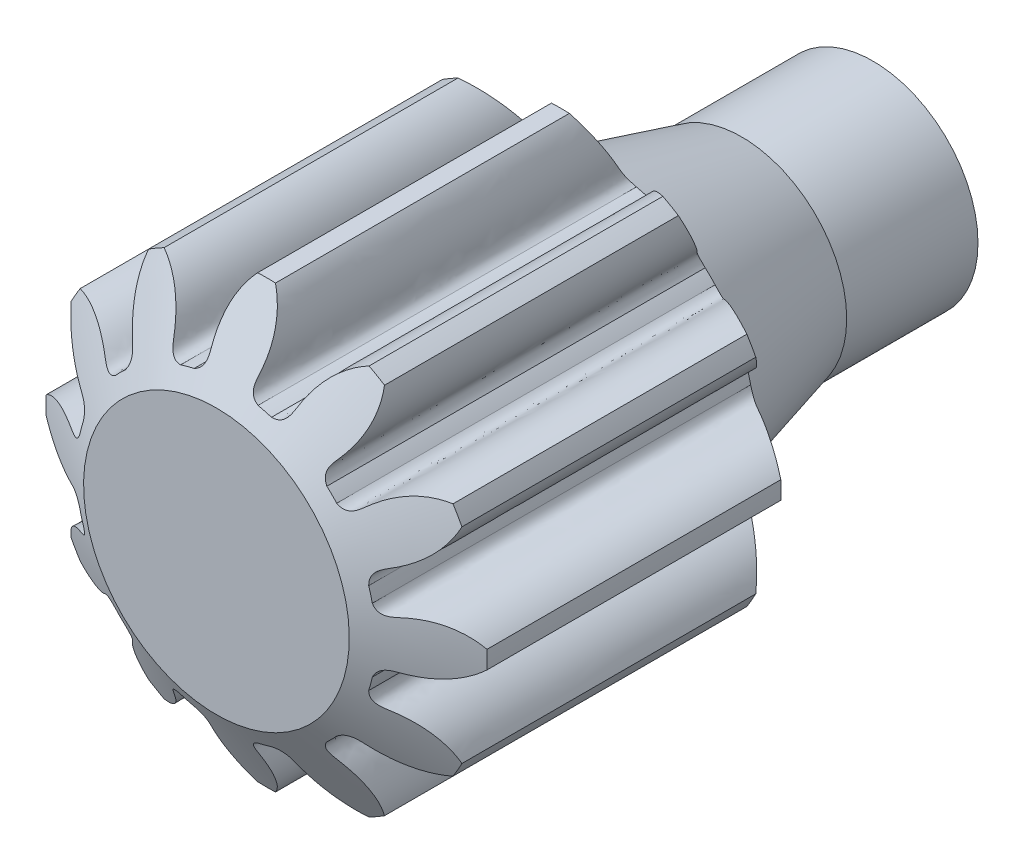
from build123d import *

# Parameters (mm, degrees)
BOSS_EXTRUDE1_DEPTH = 7.5
SKETCH5_R           = 3
CUT_EXTRUDE1_DEPTH  = 20


with BuildPart() as part:
    # Sketch1 → Boss-Extrude1 (new, symmetric)
    with BuildSketch(Plane.XY):
        with BuildLine():
            ThreePointArc((0, 8.4), (0.170181655, 8.398275907), (0.34029345, 8.393104334))
            add(Edge.make_bspline(
                [(0.34029345, 8.393104334), (0.843433283, 7.829006727), (1.095672932, 6.788355823), (0.793501255, 5.752328572), (1.218049617, 5.568335041)],
                knots=[0, 0, 0, 0, 0.704221176, 1, 1, 1, 1], degree=3))
            ThreePointArc((1.218049617, 5.568335041), (1.475268557, 5.50577721), (1.729305609, 5.431344411))
            add(Edge.make_bspline(
                [(3.901849394, 7.438788295), (3.184068714, 7.201835354), (2.445297318, 6.426725059), (2.188972041, 5.378413302), (1.729305609, 5.431344411)],
                knots=[0, 0, 0, 0, 0.704221176, 1, 1, 1, 1], degree=3))
            ThreePointArc((3.901849394, 7.438788295), (4.051756317, 7.358211111), (4.2, 7.274613392))
            ThreePointArc((4.2, 7.274613392), (4.34651959, 7.188029456), (4.49125494, 7.098494845))
            add(Edge.make_bspline(
                [(4.49125494, 7.098494845), (4.644938013, 6.358402071), (4.343058505, 5.331052126), (3.563356531, 4.584912047), (3.839029432, 4.213294794)],
                knots=[0, 0, 0, 0, 0.704221176, 1, 1, 1, 1], degree=3))
            ThreePointArc((3.839029432, 4.213294794), (4.030508653, 4.030508653), (4.213294794, 3.839029432))
            add(Edge.make_bspline(
                [(7.098494845, 4.49125494), (6.358402071, 4.644938013), (5.331052126, 4.343058505), (4.584912047, 3.563356531), (4.213294794, 3.839029432)],
                knots=[0, 0, 0, 0, 0.704221176, 1, 1, 1, 1], degree=3))
            ThreePointArc((7.098494845, 4.49125494), (7.188029456, 4.34651959), (7.274613392, 4.2))
            ThreePointArc((7.274613392, 4.2), (7.358211111, 4.051756317), (7.438788295, 3.901849394))
            add(Edge.make_bspline(
                [(7.438788295, 3.901849394), (7.201835354, 3.184068714), (6.426725059, 2.445297318), (5.378413302, 2.188972041), (5.431344411, 1.729305609)],
                knots=[0, 0, 0, 0, 0.704221176, 1, 1, 1, 1], degree=3))
            ThreePointArc((5.431344411, 1.729305609), (5.50577721, 1.475268557), (5.568335041, 1.218049617))
            add(Edge.make_bspline(
                [(8.393104334, 0.34029345), (7.829006727, 0.843433283), (6.788355823, 1.095672932), (5.752328572, 0.793501255), (5.568335041, 1.218049617)],
                knots=[0, 0, 0, 0, 0.704221176, 1, 1, 1, 1], degree=3))
            ThreePointArc((8.393104334, 0.34029345), (8.398275907, 0.170181655), (8.4, 0))
            ThreePointArc((8.4, 0), (8.398275907, -0.170181655), (8.393104334, -0.34029345))
            add(Edge.make_bspline(
                [(8.393104334, -0.34029345), (7.829006727, -0.843433283), (6.788355823, -1.095672932), (5.752328572, -0.793501255), (5.568335041, -1.218049617)],
                knots=[0, 0, 0, 0, 0.704221176, 1, 1, 1, 1], degree=3))
            ThreePointArc((5.568335041, -1.218049617), (5.50577721, -1.475268557), (5.431344411, -1.729305609))
            add(Edge.make_bspline(
                [(7.438788295, -3.901849394), (7.201835354, -3.184068714), (6.426725059, -2.445297318), (5.378413302, -2.188972041), (5.431344411, -1.729305609)],
                knots=[0, 0, 0, 0, 0.704221176, 1, 1, 1, 1], degree=3))
            ThreePointArc((7.438788295, -3.901849394), (7.358211111, -4.051756317), (7.274613392, -4.2))
            ThreePointArc((7.274613392, -4.2), (7.188029456, -4.34651959), (7.098494845, -4.49125494))
            add(Edge.make_bspline(
                [(7.098494845, -4.49125494), (6.358402071, -4.644938013), (5.331052126, -4.343058505), (4.584912047, -3.563356531), (4.213294794, -3.839029432)],
                knots=[0, 0, 0, 0, 0.704221176, 1, 1, 1, 1], degree=3))
            ThreePointArc((4.213294794, -3.839029432), (4.030508653, -4.030508653), (3.839029432, -4.213294794))
            add(Edge.make_bspline(
                [(4.49125494, -7.098494845), (4.644938013, -6.358402071), (4.343058505, -5.331052126), (3.563356531, -4.584912047), (3.839029432, -4.213294794)],
                knots=[0, 0, 0, 0, 0.704221176, 1, 1, 1, 1], degree=3))
            ThreePointArc((4.49125494, -7.098494845), (4.34651959, -7.188029456), (4.2, -7.274613392))
            ThreePointArc((4.2, -7.274613392), (4.051756317, -7.358211111), (3.901849394, -7.438788295))
            add(Edge.make_bspline(
                [(3.901849394, -7.438788295), (3.184068714, -7.201835354), (2.445297318, -6.426725059), (2.188972041, -5.378413302), (1.729305609, -5.431344411)],
                knots=[0, 0, 0, 0, 0.704221176, 1, 1, 1, 1], degree=3))
            ThreePointArc((1.729305609, -5.431344411), (1.475268557, -5.50577721), (1.218049617, -5.568335041))
            add(Edge.make_bspline(
                [(0.34029345, -8.393104334), (0.843433283, -7.829006727), (1.095672932, -6.788355823), (0.793501255, -5.752328572), (1.218049617, -5.568335041)],
                knots=[0, 0, 0, 0, 0.704221176, 1, 1, 1, 1], degree=3))
            ThreePointArc((0.34029345, -8.393104334), (0.170181655, -8.398275907), (0, -8.4))
            ThreePointArc((0, -8.4), (-0.170181655, -8.398275907), (-0.34029345, -8.393104334))
            add(Edge.make_bspline(
                [(-0.34029345, -8.393104334), (-0.843433283, -7.829006727), (-1.095672932, -6.788355823), (-0.793501255, -5.752328572), (-1.218049617, -5.568335041)],
                knots=[0, 0, 0, 0, 0.704221176, 1, 1, 1, 1], degree=3))
            ThreePointArc((-1.218049617, -5.568335041), (-1.475268557, -5.50577721), (-1.729305609, -5.431344411))
            add(Edge.make_bspline(
                [(-3.901849394, -7.438788295), (-3.184068714, -7.201835354), (-2.445297318, -6.426725059), (-2.188972041, -5.378413302), (-1.729305609, -5.431344411)],
                knots=[0, 0, 0, 0, 0.704221176, 1, 1, 1, 1], degree=3))
            ThreePointArc((-3.901849394, -7.438788295), (-4.051756317, -7.358211111), (-4.2, -7.274613392))
            ThreePointArc((-4.2, -7.274613392), (-4.34651959, -7.188029456), (-4.49125494, -7.098494845))
            add(Edge.make_bspline(
                [(-4.49125494, -7.098494845), (-4.644938013, -6.358402071), (-4.343058505, -5.331052126), (-3.563356531, -4.584912047), (-3.839029432, -4.213294794)],
                knots=[0, 0, 0, 0, 0.704221176, 1, 1, 1, 1], degree=3))
            ThreePointArc((-3.839029432, -4.213294794), (-4.030508653, -4.030508653), (-4.213294794, -3.839029432))
            add(Edge.make_bspline(
                [(-7.098494845, -4.49125494), (-6.358402071, -4.644938013), (-5.331052126, -4.343058505), (-4.584912047, -3.563356531), (-4.213294794, -3.839029432)],
                knots=[0, 0, 0, 0, 0.704221176, 1, 1, 1, 1], degree=3))
            ThreePointArc((-7.098494845, -4.49125494), (-7.188029456, -4.34651959), (-7.274613392, -4.2))
            ThreePointArc((-7.274613392, -4.2), (-7.358211111, -4.051756317), (-7.438788295, -3.901849394))
            add(Edge.make_bspline(
                [(-7.438788295, -3.901849394), (-7.201835354, -3.184068714), (-6.426725059, -2.445297318), (-5.378413302, -2.188972041), (-5.431344411, -1.729305609)],
                knots=[0, 0, 0, 0, 0.704221176, 1, 1, 1, 1], degree=3))
            ThreePointArc((-5.431344411, -1.729305609), (-5.50577721, -1.475268557), (-5.568335041, -1.218049617))
            add(Edge.make_bspline(
                [(-8.393104334, -0.34029345), (-7.829006727, -0.843433283), (-6.788355823, -1.095672932), (-5.752328572, -0.793501255), (-5.568335041, -1.218049617)],
                knots=[0, 0, 0, 0, 0.704221176, 1, 1, 1, 1], degree=3))
            ThreePointArc((-8.393104334, -0.34029345), (-8.398275907, -0.170181655), (-8.4, 0))
            ThreePointArc((-8.4, 0), (-8.398275907, 0.170181655), (-8.393104334, 0.34029345))
            add(Edge.make_bspline(
                [(-8.393104334, 0.34029345), (-7.829006727, 0.843433283), (-6.788355823, 1.095672932), (-5.752328572, 0.793501255), (-5.568335041, 1.218049617)],
                knots=[0, 0, 0, 0, 0.704221176, 1, 1, 1, 1], degree=3))
            ThreePointArc((-5.568335041, 1.218049617), (-5.50577721, 1.475268557), (-5.431344411, 1.729305609))
            add(Edge.make_bspline(
                [(-7.438788295, 3.901849394), (-7.201835354, 3.184068714), (-6.426725059, 2.445297318), (-5.378413302, 2.188972041), (-5.431344411, 1.729305609)],
                knots=[0, 0, 0, 0, 0.704221176, 1, 1, 1, 1], degree=3))
            ThreePointArc((-7.438788295, 3.901849394), (-7.358211111, 4.051756317), (-7.274613392, 4.2))
            ThreePointArc((-7.274613392, 4.2), (-7.188029456, 4.34651959), (-7.098494845, 4.49125494))
            add(Edge.make_bspline(
                [(-7.098494845, 4.49125494), (-6.358402071, 4.644938013), (-5.331052126, 4.343058505), (-4.584912047, 3.563356531), (-4.213294794, 3.839029432)],
                knots=[0, 0, 0, 0, 0.704221176, 1, 1, 1, 1], degree=3))
            ThreePointArc((-4.213294794, 3.839029432), (-4.030508653, 4.030508653), (-3.839029432, 4.213294794))
            add(Edge.make_bspline(
                [(-4.49125494, 7.098494845), (-4.644938013, 6.358402071), (-4.343058505, 5.331052126), (-3.563356531, 4.584912047), (-3.839029432, 4.213294794)],
                knots=[0, 0, 0, 0, 0.704221176, 1, 1, 1, 1], degree=3))
            ThreePointArc((-4.49125494, 7.098494845), (-4.34651959, 7.188029456), (-4.2, 7.274613392))
            ThreePointArc((-4.2, 7.274613392), (-4.051756317, 7.358211111), (-3.901849394, 7.438788295))
            add(Edge.make_bspline(
                [(-3.901849394, 7.438788295), (-3.184068714, 7.201835354), (-2.445297318, 6.426725059), (-2.188972041, 5.378413302), (-1.729305609, 5.431344411)],
                knots=[0, 0, 0, 0, 0.704221176, 1, 1, 1, 1], degree=3))
            ThreePointArc((-1.729305609, 5.431344411), (-1.475268557, 5.50577721), (-1.218049617, 5.568335041))
            add(Edge.make_bspline(
                [(-0.34029345, 8.393104334), (-0.843433283, 7.829006727), (-1.095672932, 6.788355823), (-0.793501255, 5.752328572), (-1.218049617, 5.568335041)],
                knots=[0, 0, 0, 0, 0.704221176, 1, 1, 1, 1], degree=3))
            ThreePointArc((-0.34029345, 8.393104334), (-0.170181655, 8.398275907), (0, 8.4))
        make_face()
    extrude(amount=BOSS_EXTRUDE1_DEPTH, both=True)

    # Sketch2 → Cut-Revolve1 (revolve, cut)
    with BuildSketch(Plane(origin=(0, 0, 0), x_dir=(0, 0, -1), z_dir=(1, 0, 0)), mode=Mode.PRIVATE) as cut_revolve1_sk:
        Polygon((-7.5, 5.05917883), (-5.5, 8.55917883), (-7.5, 8.55917883), align=None)
        Polygon((5.5, 8.55917883), (7.5, 5.336739763), (7.5, 8.55917883), align=None)
    revolve(cut_revolve1_sk.sketch.rotate(Axis((0, 0, -7.5), (0, 0, 1)), 182.321751842), axis=Axis((0, 0, -7.5), (0, 0, 1)), mode=Mode.SUBTRACT)

    # Sketch4 → Revolve1 (revolve)
    with BuildSketch(Plane(origin=(0, 0, 0), x_dir=(0, 0, -1), z_dir=(1, 0, 0)), mode=Mode.PRIVATE) as revolve1_sk:
        Polygon((7.5, 5.336739763), (12.5, 4), (17.5, 4), (17.5, 0), (7.5, 0), align=None)
    revolve(revolve1_sk.sketch.rotate(Axis((0, 0, 0), (0, 0, -1)), 90), axis=Axis((0, 0, 0), (0, 0, -1)))

    # Sketch5 → Cut-Extrude1 (cut)
    with BuildSketch(Plane(origin=(0, 0, -17.5), x_dir=(-1, 0, 0), z_dir=(0, 0, -1))):
        Circle(SKETCH5_R)
    extrude(amount=-CUT_EXTRUDE1_DEPTH, mode=Mode.SUBTRACT)


solid = part.part
